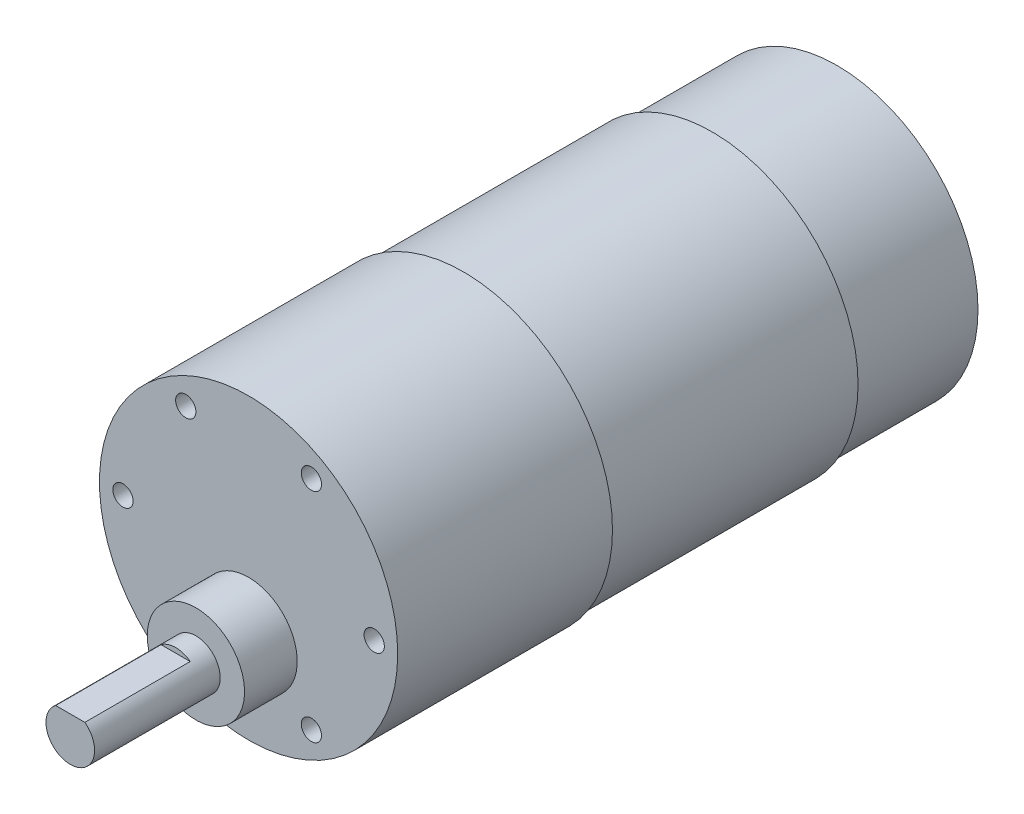
from build123d import *

# Parameters (mm, degrees)
SKETCH1_R                       = 17.4
BOSS_EXTRUDE1_DEPTH             = 15.4
SKETCH2_R                       = 18
BOSS_EXTRUDE2_DEPTH             = 30.7
SKETCH3_R                       = 18.4
BOSS_EXTRUDE3_DEPTH             = 26.5
SKETCH4_R                       = 6
BOSS_EXTRUDE4_DEPTH             = 6.5
SKETCH5_R                       = 3
BOSS_EXTRUDE5_DEPTH             = 15.5
CUT_EXTRUDE1_START              = -13
CUT_EXTRUDE1_DEPTH              = 13
TAP_DRILL_FOR_M3X0_5_TAP1_D     = 2.5
TAP_DRILL_FOR_M3X0_5_TAP1_DEPTH = 10.76


with BuildPart() as part:
    # Sketch1 → Boss-Extrude1 (new body)
    with BuildSketch(Plane.XY):
        with Locations(Location((0, 0, 0), (0, 0, 180))):
            Circle(SKETCH1_R)
    extrude(amount=BOSS_EXTRUDE1_DEPTH)

    # Sketch2 → Boss-Extrude2 (add)
    with BuildSketch(Plane.XY.offset(15.4)):
        Circle(SKETCH2_R)
    extrude(amount=BOSS_EXTRUDE2_DEPTH)

    # Sketch3 → Boss-Extrude3 (add)
    with BuildSketch(Plane.XY.offset(46.1)):
        Circle(SKETCH3_R)
    extrude(amount=BOSS_EXTRUDE3_DEPTH)

    # Sketch4 → Boss-Extrude4 (add)
    with BuildSketch(Plane.XY.offset(72.6)):
        with Locations(Location((0, -7, 0), (0, 0, 180))):
            Circle(SKETCH4_R)
    extrude(amount=BOSS_EXTRUDE4_DEPTH)

    # Sketch5 → Boss-Extrude5 (add)
    with BuildSketch(Plane.XY.offset(79.1)):
        with Locations((0, -7)):
            Circle(SKETCH5_R)
    extrude(amount=BOSS_EXTRUDE5_DEPTH)

    # Sketch6 → Cut-Extrude1 (cut)
    with BuildSketch(Plane.XY.offset(94.6).offset(CUT_EXTRUDE1_START)):
        with BuildLine():
            Line((-1.8, -4.6), (1.8, -4.6))
            ThreePointArc((1.8, -4.6), (0, -4), (-1.8, -4.6))
        make_face()
    extrude(amount=CUT_EXTRUDE1_DEPTH, mode=Mode.SUBTRACT)

    # Tap Drill for M3x0.5 Tap1
    with Locations(Plane.XY.offset(72.6)):
        with Locations((-15.5, 0), (-7.75, 13.423393759), (7.75, 13.423393759), (15.5, 0), (7.75, -13.423393759), (-7.75, -13.423393759)):
            Hole(TAP_DRILL_FOR_M3X0_5_TAP1_D / 2, depth=TAP_DRILL_FOR_M3X0_5_TAP1_DEPTH)


solid = part.part
